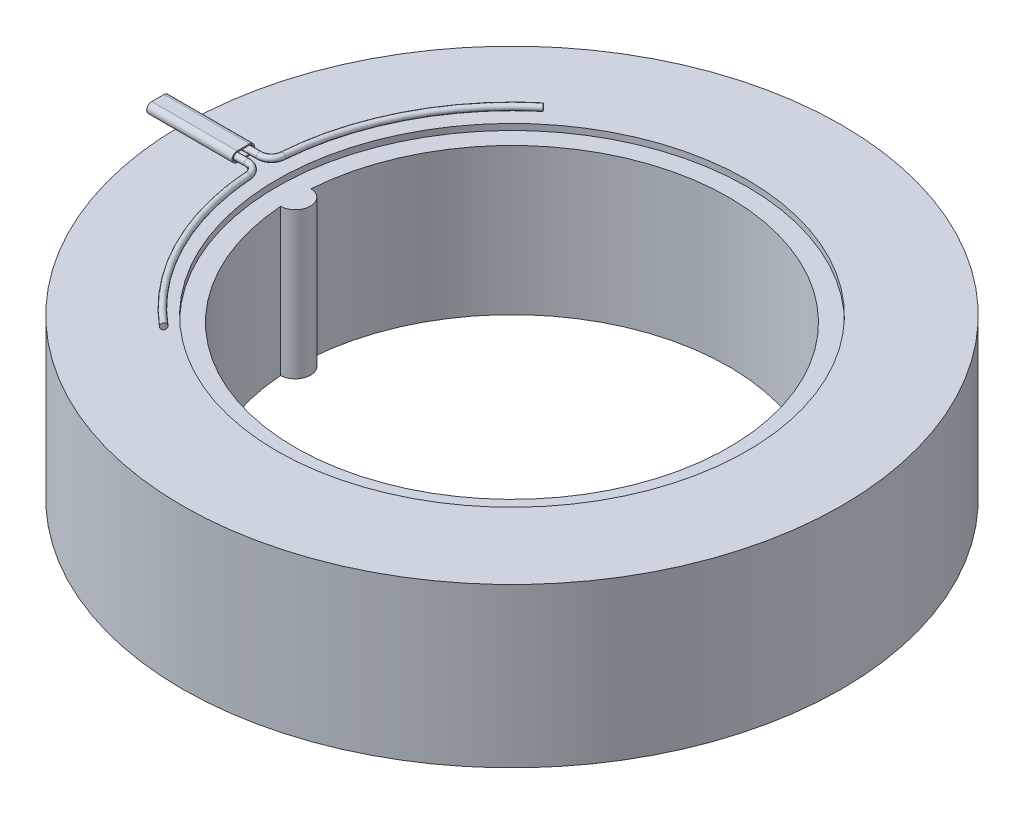
from build123d import *

# Parameters (mm, degrees)
SKETCH1_W                       = 1.5
SKETCH1_H                       = 12
SKETCH2_W                       = 7.75
SKETCH2_H                       = 13
BOSS_EXTRUDE1_REACH             = 40.733
SKETCH3_R                       = 1.25
BOSS_EXTRUDE1_DIRECTION_2_REACH = 40.733
SWEEP1_PROFILE_R                = 0.25
EXTRUDE_THIN1_START             = -22
EXTRUDE_THIN1_DEPTH             = 7


with BuildPart() as part:
    # Sketch1 → Revolve1 (revolve)
    with BuildSketch(Plane.XY, mode=Mode.PRIVATE) as revolve1_sk:
        with Locations((-18.5, 0)):
            Rectangle(SKETCH1_W, SKETCH1_H)
    revolve(revolve1_sk.sketch.rotate(Axis((0, 0, 0), (0, -1, 0)), 270), axis=Axis((0, 0, 0), (0, -1, 0)))

    # Boss-Extrude1: up to this face of the body (flat: up to its plane)
    boss_extrude1_end = Plane(part.part.faces().sort_by_distance((0, 6, -18.705527778))[0])
    # Sketch3 → Boss-Extrude1 (add, up to the picked face)
    with BuildSketch(Plane(origin=(0, 0, 0), x_dir=(1, 0, 0), z_dir=(0, 1, 0)), mode=Mode.PRIVATE) as boss_extrude1_sk1:
        with Locations((-17.75, 0)):
            Circle(SKETCH3_R)
    boss_extrude1_tool1 = split(extrude(boss_extrude1_sk1.sketch, amount=BOSS_EXTRUDE1_REACH, mode=Mode.PRIVATE), bisect_by=boss_extrude1_end, keep=Keep.BOTH, mode=Mode.PRIVATE)
    add(boss_extrude1_tool1.solids().sort_by(Axis((-17.75, 0, 0), (0, 1, 0)))[0])

    # Boss-Extrude1 direction 2: up to this face of the body (flat: up to its plane)
    boss_extrude1_direction_2_end = Plane(part.part.faces().sort_by_distance((0, -6, -18.294472222))[0])
    # Sketch3 → Boss-Extrude1 direction 2 (add, up to the picked face)
    with BuildSketch(Plane(origin=(0, 0, 0), x_dir=(1, 0, 0), z_dir=(0, 1, 0)), mode=Mode.PRIVATE) as boss_extrude1_direction_2_sk1:
        with Locations((-17.75, 0)):
            Circle(SKETCH3_R)
    boss_extrude1_direction_2_tool1 = split(extrude(boss_extrude1_direction_2_sk1.sketch, amount=-BOSS_EXTRUDE1_DIRECTION_2_REACH, mode=Mode.PRIVATE), bisect_by=boss_extrude1_direction_2_end, keep=Keep.BOTH, mode=Mode.PRIVATE)
    add(boss_extrude1_direction_2_tool1.solids().sort_by(Axis((-17.75, 0, 0), (0, -1, 0)))[0])


with BuildPart() as body_2:
    # Sketch2 → Revolve2 (revolve)
    with BuildSketch(Plane.XY, mode=Mode.PRIVATE) as revolve2_sk:
        with Locations((-23.125, 0)):
            Rectangle(SKETCH2_W, SKETCH2_H)
    revolve(revolve2_sk.sketch.rotate(Axis((0, 0, 0), (0, -1, 0)), 270), axis=Axis((0, 0, 0), (0, -1, 0)))


with BuildPart() as body_3:
    # Sweep1: sweep along a path in Sketch4
    with BuildLine(Plane(origin=(0, 7, 0), x_dir=(1, 0, 0), z_dir=(0, 1, 0))) as sweep1_path:
        Line((-25.807382336, 0.5), (-21.196992711, 0.5))
        ThreePointArc((-21.196992711, 0.5), (-20.515299318, 0.768362031), (-20.199487172, 1.429411765))
        ThreePointArc((-20.199487172, 1.429411765), (-18.029453574, 9.219615167), (-12.984102621, 15.53948452))
    # Sweep1 profile (on start of the path) → Sweep1 (sweep)
    with BuildSketch(Plane(origin=(-25.807382336, 7, -0.5), x_dir=(0, 0, 1), z_dir=(1, 0, 0))):
        Circle(SWEEP1_PROFILE_R)
    sweep(path=sweep1_path.line)


with BuildPart() as body_4:
    # Mirror2: mirrored copy
    add(body_3.part.mirror(Plane.XY))


with BuildPart() as body_5:
    # Sketch23 → Extrude-Thin1 (new body)
    with BuildSketch(Plane(origin=(0, 0, 0), x_dir=(0, 0, -1), z_dir=(1, 0, 0)).offset(EXTRUDE_THIN1_START)):
        with BuildLine():
            Line((-0.5, 7.414880724), (0.5, 7.414880724))
            ThreePointArc((0.5, 7.414880724), (0.914880724, 7), (0.5, 6.585119276))
            Line((0.5, 6.585119276), (-0.5, 6.585119276))
            ThreePointArc((-0.5, 6.585119276), (-0.914880724, 7), (-0.5, 7.414880724))
        make_face()
        with BuildLine():
            Line((-0.5, 7.314880724), (0.5, 7.314880724))
            ThreePointArc((0.5, 7.314880724), (0.814880724, 7), (0.5, 6.685119276))
            Line((0.5, 6.685119276), (-0.5, 6.685119276))
            ThreePointArc((-0.5, 6.685119276), (-0.814880724, 7), (-0.5, 7.314880724))
        make_face(mode=Mode.SUBTRACT)
    extrude(amount=-EXTRUDE_THIN1_DEPTH)


solid = Compound([part.part, body_2.part, body_3.part, body_4.part, body_5.part])
